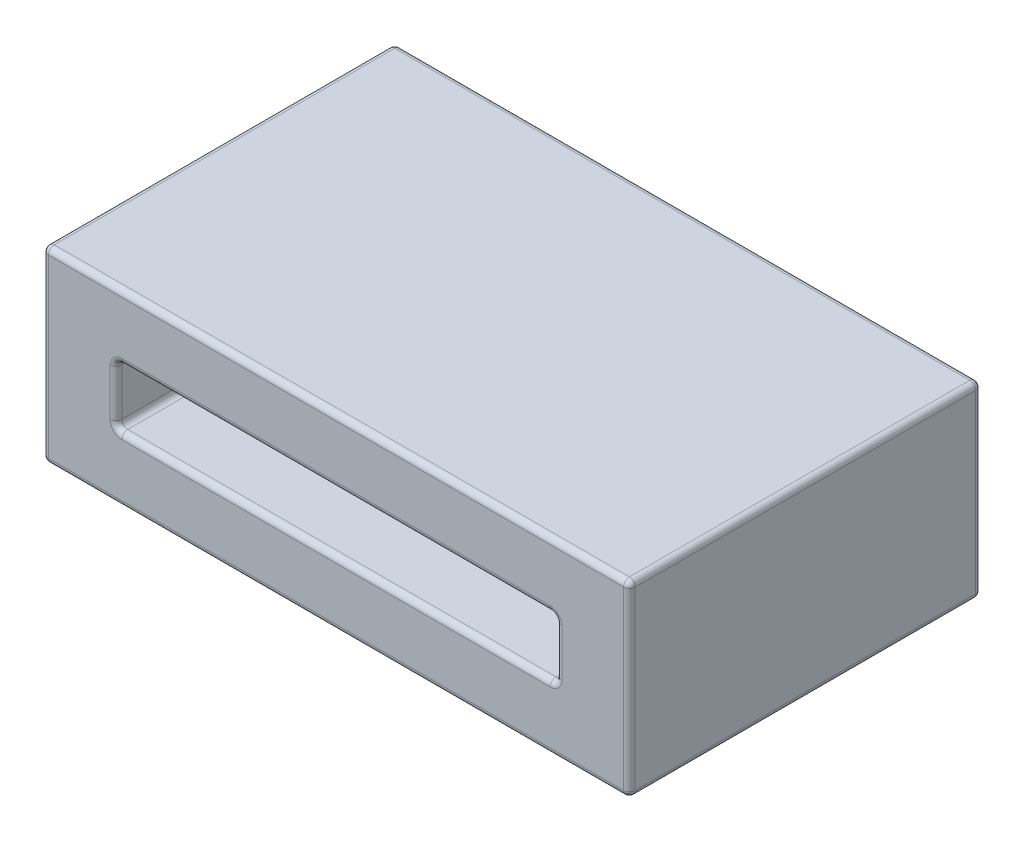
from build123d import *

# Parameters (mm, degrees)
SKETCH1_W           = 100
SKETCH1_H           = 60
BOSS_EXTRUDE1_DEPTH = 32
SKETCH2_W           = 75
SKETCH2_H           = 10
CUT_EXTRUDE1_DEPTH  = 85.403791384
FILLET2_R           = 1


with BuildPart() as part:
    # Sketch1 → Boss-Extrude1 (new body)
    with BuildSketch(Plane(origin=(0, 0, 0), x_dir=(1, 0, 0), z_dir=(0, 1, 0))):
        Rectangle(SKETCH1_W, SKETCH1_H)
    extrude(amount=BOSS_EXTRUDE1_DEPTH)

    # Sketch2 → Cut-Extrude1 (cut, through all)
    with BuildSketch(Plane.XY.offset(30)):
        with Locations((0, 16)):
            Rectangle(SKETCH2_W, SKETCH2_H)
    extrude(amount=-CUT_EXTRUDE1_DEPTH, mode=Mode.SUBTRACT)

    # Fillet2
    fillet2_edges = [part.edges().sort_by_distance(p)[0] for p in [
        (-50, 32, 0),
        (0, 32, 30),
        (-37.5, 16, -30),
        (-37.5, 11, 0),
        (0, 21, -30),
        (-37.5, 21, 0),
        (37.5, 16, -30),
        (37.5, 21, 0),
        (0, 11, -30),
        (37.5, 11, 0),
        (-37.5, 16, 30),
        (0, 11, 30),
        (37.5, 16, 30),
        (0, 21, 30),
        (50, 32, 0),
        (0, 0, 30),
        (-50, 0, 0),
        (0, 0, -30),
        (50, 0, 0),
        (50, 16, 30),
        (-50, 16, 30),
        (-50, 16, -30),
        (50, 16, -30),
        (0, 32, -30),
    ]]
    fillet(fillet2_edges, radius=FILLET2_R)


solid = part.part
